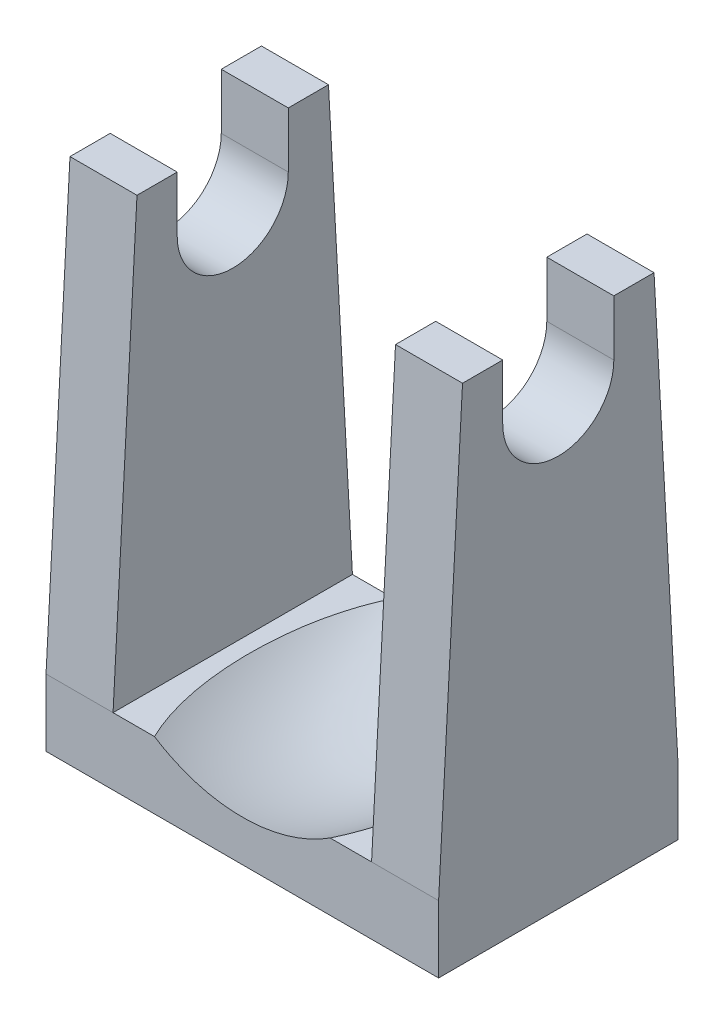
from build123d import *

# Parameters (mm, degrees)
BOSS_EXTRUDE1_DEPTH     = 3.175
CUT_EXTRUDE1_DEPTH      = 15.674509254
CUT_EXTRUDE1_DEPTH_BACK = 15.674509254
CUT_EXTRUDE2_DEPTH      = 15.674509254


with BuildPart() as part:
    # Sketch1 → Boss-Extrude1 (new, symmetric)
    with BuildSketch(Plane.XY):
        Polygon((5.207, 0), (-5.207, 0), (-5.207, 13.3472), (-3.429, 13.3472), (-3.429, 1.778), (3.429, 1.778), (3.429, 13.3472), (5.207, 13.3472), align=None)
    extrude(amount=BOSS_EXTRUDE1_DEPTH, both=True)

    # Sketch2 → Cut-Extrude1 (cut, two sides: drawn at the far end of the back side and taken through both)
    with BuildSketch(Plane(origin=(0, 0, 0), x_dir=(0, 0, -1), z_dir=(1, 0, 0)).offset(-CUT_EXTRUDE1_DEPTH_BACK)):
        with BuildLine():
            Line((1.4732, 13.3472), (1.4732, 11.874))
            ThreePointArc((1.4732, 11.874), (0, 10.4008), (-1.4732, 11.874))
            Line((-1.4732, 11.874), (-1.4732, 13.3472))
            ThreePointArc((-1.4732, 13.3472), (0, 14.8204), (1.4732, 13.3472))
        make_face()
    extrude(amount=CUT_EXTRUDE1_DEPTH + CUT_EXTRUDE1_DEPTH_BACK, mode=Mode.SUBTRACT)

    # Sketch4 → Cut-Extrude2 (cut, symmetric)
    with BuildSketch(Plane(origin=(0, 0, 0), x_dir=(0, 0, -1), z_dir=(1, 0, 0))):
        Polygon((-3.175, 1.778), (-3.175, 13.3472), (-2.54, 13.3472), align=None)
    cut_extrude2 = extrude(amount=CUT_EXTRUDE2_DEPTH, both=True, mode=Mode.SUBTRACT)

    # Mirror1: Cut-Extrude2 across plane
    add(cut_extrude2.mirror(Plane.XY), mode=Mode.SUBTRACT)

    # Sketch3 → Cut-Revolve1 (revolve, cut)
    with BuildSketch(Plane.XY):
        with BuildLine():
            Line((-3.11999347, 1.905), (3.11999347, 1.905))
            ThreePointArc((3.11999347, 1.905), (0, 0.6345), (-3.11999347, 1.905))
        make_face()
    revolve(axis=Axis((0, 11.874, 0), (1, 0, 0)), mode=Mode.SUBTRACT)


solid = part.part
